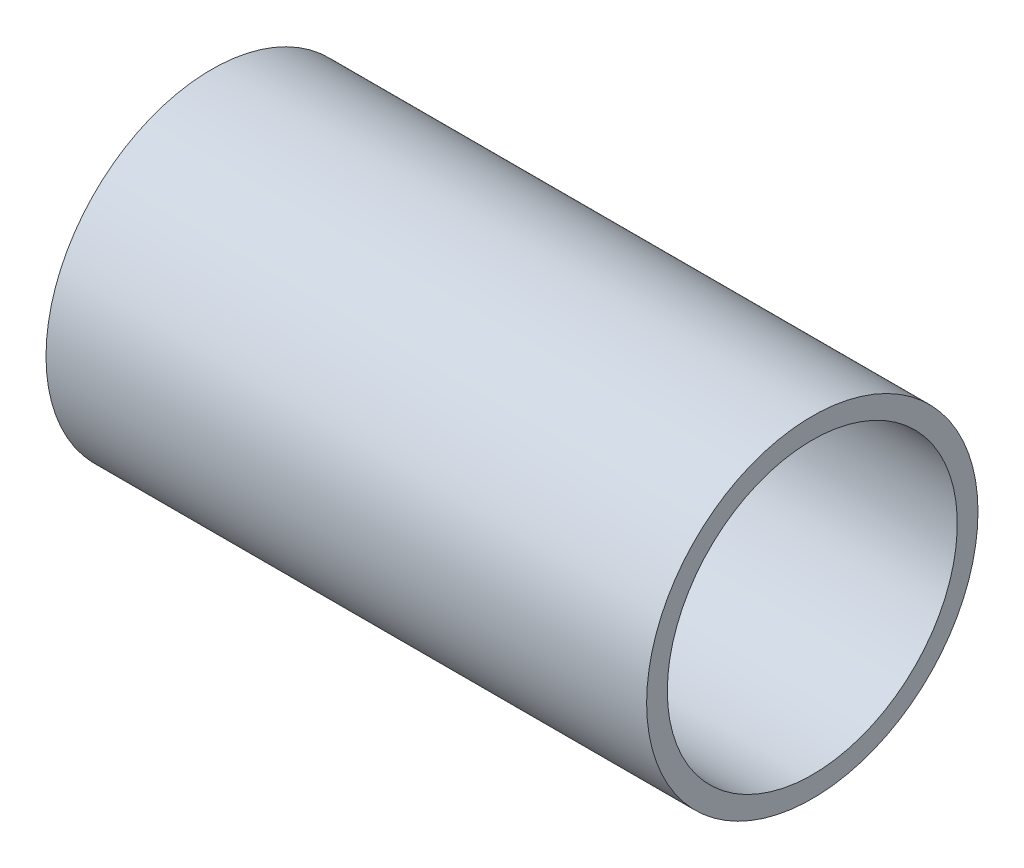
from build123d import *

# Parameters (mm, degrees)
SKIZZE1_W = 29
SKIZZE1_H = 1


with BuildPart() as part:
    # Skizze1 → Rotation1 (revolve)
    with BuildSketch(Plane.XY):
        with Locations((-21.116858238, 7.5)):
            Rectangle(SKIZZE1_W, SKIZZE1_H)
    revolve(axis=Axis((-36.796934866, 0, 0), (1, 0, 0)))


solid = part.part
